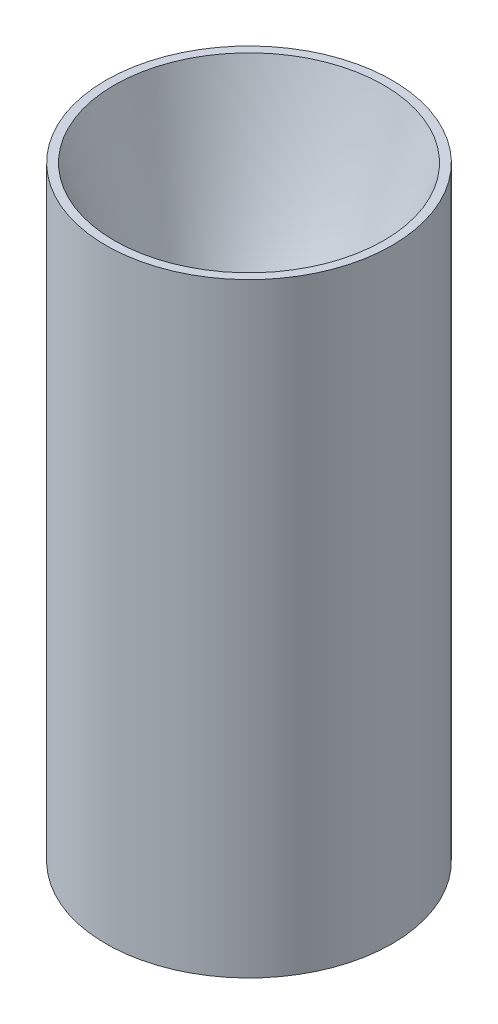
from build123d import *

# Parameters (mm, degrees)
CIRPATTERN1_COUNT              = 8
F_1_4_0_2500_DOWEL_HOLE1_D     = 6.35
F_1_4_0_2500_DOWEL_HOLE1_DEPTH = 9.906
F_1_4_0_2500_DOWEL_HOLE1_TIP   = 1.907732465


with BuildPart() as part:
    # Sketch1 → Revolve2 (revolve)
    with BuildSketch(Plane.XY, mode=Mode.PRIVATE) as revolve2_sk:
        with BuildLine():
            Line((71.727523602, 109.927507641), (76.194467874, 109.927507641))
            Line((76.194467874, 109.927507641), (76.194467874, -212.127513222))
            Line((76.194467874, -212.127513222), (53.881527661, -212.127513222))
            Line((53.881527661, -212.127513222), (53.881527661, -59.727513222))
            add(Edge.make_bspline(
                [(53.881527661, -59.727513222), (53.88152643, -59.656983156), (53.880997287, -59.515406102), (53.878621437, -59.181564616), (53.872296838, -58.904795492), (53.862811351, -58.532567487), (53.850168453, -58.212837621), (53.830417626, -57.781594442), (53.800405285, -57.280959899), (53.756193121, -56.687998165), (53.677288452, -55.848480365), (53.577426861, -55.00816586), (53.456675786, -54.17243543), (53.286810822, -53.172425239), (53.092064187, -52.177442821), (52.86637512, -51.188539083), (52.610014224, -50.207489038), (52.32928934, -49.23307774), (52.024348739, -48.265969223), (51.633537831, -47.149135067), (51.139520361, -45.890408405), (50.598733752, -44.650968803), (50.012060927, -43.432701525), (49.38012023, -42.237093238), (48.704125229, -41.066154878), (47.984475519, -39.920972657), (47.223102138, -38.804076239), (46.51986906, -37.851451785), (45.893537937, -37.055672122), (45.35281768, -36.403381282), (44.915126948, -35.894247632), (44.514776189, -35.446992657), (44.181457503, -35.084631185), (43.873924624, -34.760340151), (43.674072406, -34.55154945), (43.444392072, -34.318516287), (43.343783151, -34.217162055), (43.293911001, -34.167289665)],
                knots=[0.082637729, 0.082637729, 0.082637729, 0.082637729, 0.082637729, 0.092574926, 0.102512123, 0.11244932, 0.122386517, 0.132323714, 0.142260911, 0.162135305, 0.182009699, 0.201884093, 0.24163288, 0.261507274, 0.281381668, 0.321130456, 0.360879243, 0.380753637, 0.400628031, 0.440376819, 0.480125606, 0.519874394, 0.559623181, 0.599371969, 0.639120757, 0.678869544, 0.718618332, 0.75836712, 0.798115907, 0.817990301, 0.837864695, 0.857739089, 0.877613483, 0.88755068, 0.897487877, 0.907425074, 0.91736227, 0.91736227, 0.91736227, 0.91736227, 0.91736227], degree=4))
            Line((43.293911001, -34.167289665), (34.686282803, -25.559661468))
            add(Edge.make_bspline(
                [(24.099067874, 0.000160672), (24.099069105, -0.070367974), (24.099598252, -0.213423517), (24.101973937, -0.543022243), (24.108298331, -0.823999723), (24.117783452, -1.194661398), (24.130425744, -1.513274385), (24.146225968, -1.86177893), (24.165181227, -2.193546199), (24.192818841, -2.617908727), (24.232287047, -3.121873274), (24.303299707, -3.879818002), (24.423126678, -4.886289716), (24.599486044, -6.056550088), (24.850885233, -7.385005743), (25.151795313, -8.703413844), (25.501770623, -10.009476539), (25.900360983, -11.301658928), (26.346945392, -12.577938667), (26.841003323, -13.836726817), (27.381673122, -15.076036463), (27.968479387, -16.294449129), (28.600139398, -17.489778131), (29.276532396, -18.661127096), (29.995445102, -19.805582737), (30.758021999, -20.923699417), (31.459167193, -21.874251104), (32.088736123, -22.673284825), (32.624128416, -23.320261484), (33.072255768, -23.839844364), (33.508450026, -24.329655594), (33.935826121, -24.788323739), (34.24555864, -25.11370766), (34.536859958, -25.409488397), (34.636412426, -25.509789283), (34.686282803, -25.559661468)],
                knots=[0.082637729, 0.082637729, 0.082637729, 0.082637729, 0.082637729, 0.092574926, 0.102512123, 0.11244932, 0.122386517, 0.132323714, 0.142260911, 0.152198108, 0.162135305, 0.182009699, 0.201884093, 0.24163288, 0.281381668, 0.321130456, 0.360879243, 0.400628031, 0.440376819, 0.480125606, 0.519874394, 0.559623181, 0.599371969, 0.639120757, 0.678869544, 0.718618332, 0.75836712, 0.798115907, 0.817990301, 0.837864695, 0.857739089, 0.877613483, 0.897487877, 0.907425074, 0.91736227, 0.91736227, 0.91736227, 0.91736227, 0.91736227], degree=4))
            add(Edge.make_bspline(
                [(24.099067874, 0.000160672), (24.0990685, 0.036053324), (24.099606331, 0.110274362), (24.102023723, 0.267801742), (24.108461568, 0.427224789), (24.120533599, 0.646924939), (24.141435087, 0.901594), (24.175184719, 1.202697945), (24.226499305, 1.54221117), (24.290543701, 1.881157449), (24.367141601, 2.216515092), (24.456323571, 2.549400093), (24.557741413, 2.878253317), (24.671619071, 3.203507713), (24.797196771, 3.523787829), (24.935285977, 3.839827405), (25.084070301, 4.149442857), (25.246012222, 4.454943795), (25.416488505, 4.751462248), (25.602514721, 5.045864533), (25.79178827, 5.325679608), (26.004405474, 5.610888215), (26.178876374, 5.83307432), (26.366345756, 6.050112309), (26.504555248, 6.208802318), (26.67044207, 6.382282451), (26.744520261, 6.458639514), (26.795279203, 6.509400323)],
                knots=[0.082568816, 0.082568816, 0.082568816, 0.082568816, 0.082568816, 0.102426634, 0.122284453, 0.142142271, 0.162000089, 0.201715725, 0.241431362, 0.281146998, 0.320862634, 0.360578271, 0.400293907, 0.440009544, 0.47972518, 0.519440816, 0.559156453, 0.598872089, 0.638587725, 0.678303362, 0.718018998, 0.757734635, 0.797450271, 0.837165907, 0.857023726, 0.876881544, 0.91659718, 0.91659718, 0.91659718, 0.91659718, 0.91659718], degree=4))
            add(Edge.make_bspline(
                [(26.795279203, 6.509400323), (49.261401403, 34.636114842), (71.727523602, 109.927507641)],
                knots=[0, 0, 0, 1, 1, 1], degree=2))
        make_face()
    revolve(revolve2_sk.sketch.rotate(Axis((-0.005532126, 165.815985114, 0), (0, -1, 0)), 180), axis=Axis((-0.005532126, 165.815985114, 0), (0, -1, 0)))

    # Sketch4 → 3/8-24 Tapped Hole1 (revolve, cut)
    with BuildSketch(Plane(origin=(65.2, -212.127513222, 0), x_dir=(0, 0, -1), z_dir=(1, 0, 0))):
        Polygon((0, 0), (0, 27.533468714), (4.2164, 25), (4.2164, 0), align=None)
    f_3_8_24_tapped_hole1 = revolve(axis=Axis((65.2, -218.477513222, 0), (0, 1, 0)), mode=Mode.SUBTRACT)

    # CirPattern1: 3/8-24 Tapped Hole1 ×8 about axis
    cirpattern1_axis = Axis((0, -228.487022387, 0), (-1.634718801334702e-05, 0.9999999998663848, 0))
    for i in range(1, CIRPATTERN1_COUNT):
        add(f_3_8_24_tapped_hole1.rotate(cirpattern1_axis, i * 360 / CIRPATTERN1_COUNT), mode=Mode.SUBTRACT)

    # 1/4 (0.2500) Dowel Hole1
    with Locations(Plane(origin=(0, -212.127513222, 0), x_dir=(-1, 0, 0), z_dir=(0, -1, 0))):
        with Locations((-60.236831784, 24.951234372), (60.23705925, -24.95068522)):
            Hole(F_1_4_0_2500_DOWEL_HOLE1_D / 2, depth=F_1_4_0_2500_DOWEL_HOLE1_DEPTH)
            with Locations((0, 0, -(F_1_4_0_2500_DOWEL_HOLE1_DEPTH + F_1_4_0_2500_DOWEL_HOLE1_TIP / 2))):  # 118° drill point
                Cone(0, F_1_4_0_2500_DOWEL_HOLE1_D / 2, F_1_4_0_2500_DOWEL_HOLE1_TIP, mode=Mode.SUBTRACT)


solid = part.part
